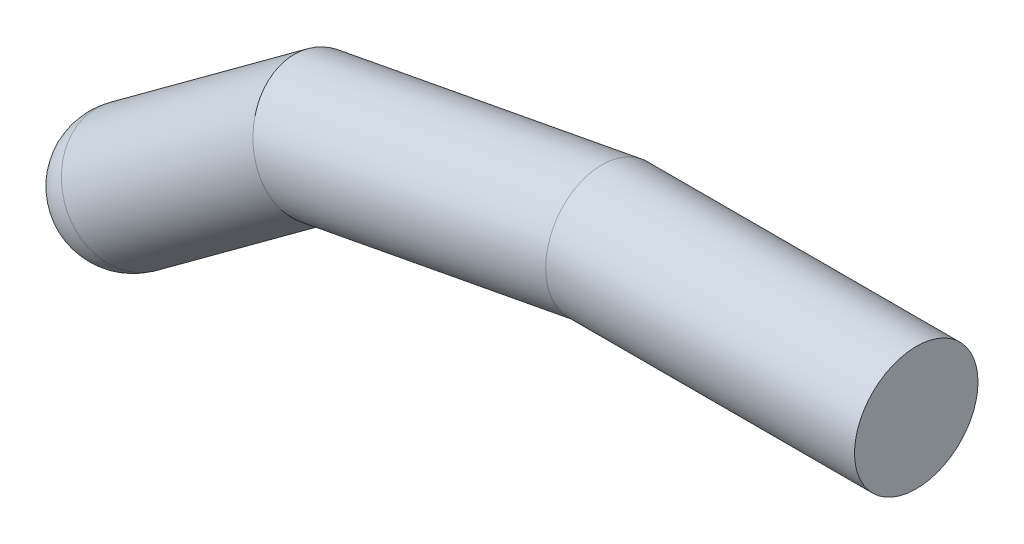
from build123d import *

# Parameters (mm, degrees)
SKETCH2_R = 4
FILLET1_R = 4


with BuildPart() as part:
    # Sweep1: sweep along a path in Sketch1
    with BuildLine(Plane.XY) as sweep1_path:
        Line((0, 0), (-20, 0))
        Line((-20, 0), (-38.670509569, -3.523077123))
        Line((-38.670509569, -3.523077123), (-53.980267561, -14.775246259))
    # Sketch2 → Sweep1 (sweep)
    with BuildSketch(Plane(origin=(0, 0, 0), x_dir=(0, 0, -1), z_dir=(1, 0, 0))):
        Circle(SKETCH2_R)
    sweep(path=sweep1_path.line, transition=Transition.RIGHT)

    # Fillet1
    fillet1_edges = [part.edges().sort_by_distance(p)[0] for p in [
        (-53.980267561, -14.775246259, 4),
    ]]
    fillet(fillet1_edges, radius=FILLET1_R)


solid = part.part
